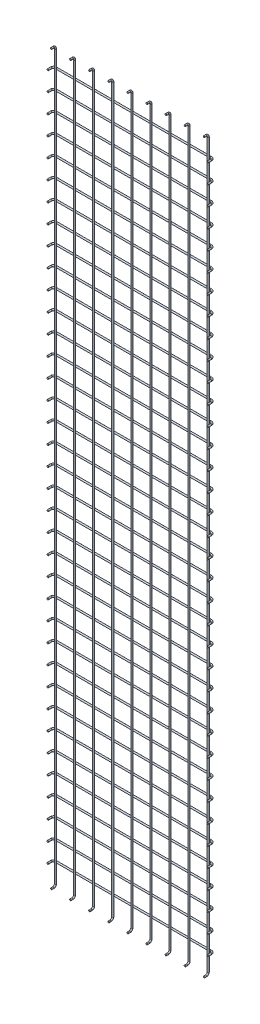
from build123d import *

# Parameters (mm, degrees)
SKETCH_2_R             = 2
PATTERN_LINEAR_1_COUNT = 5
PATTERN_LINEAR_1_PITCH = 50
SKETCH_4_R             = 2
PATTERN_LINEAR_7_COUNT = 19
PATTERN_LINEAR_7_PITCH = 50
PATTERN_LINEAR_8_COUNT = 19
PATTERN_LINEAR_8_PITCH = 50


with BuildPart() as part:
    # По траектории1: sweep along a path in Эскиз1
    with BuildLine(Plane(origin=(0, 0, 0), x_dir=(0, 0, -1), z_dir=(1, 0, 0))) as sweep_1_path:
        Line((-11, 953), (-6, 953))
        ThreePointArc((-6, 953), (-1.757359313, 951.242640687), (0, 947))
        Line((0, 947), (0, -947))
        ThreePointArc((0, -947), (-1.757359313, -951.242640687), (-6, -953))
        Line((-6, -953), (-11, -953))
    # Эскиз2 → По траектории1 (sweep)
    with BuildSketch(Plane.XY.offset(11)):
        with Locations((0, -953)):
            Circle(SKETCH_2_R)
    sweep(path=sweep_1_path.line)


with BuildPart() as pattern_linear_1_1:
    # Линейный массив1: pattern copy
    add(part.part.moved(Location(Vector(-1, 0, 0) * (1 * PATTERN_LINEAR_1_PITCH))))


with BuildPart() as pattern_linear_1_2:
    # Линейный массив1: pattern copy
    add(part.part.moved(Location(Vector(-1, 0, 0) * (2 * PATTERN_LINEAR_1_PITCH))))


with BuildPart() as pattern_linear_1_3:
    # Линейный массив1: pattern copy
    add(part.part.moved(Location(Vector(-1, 0, 0) * (3 * PATTERN_LINEAR_1_PITCH))))


with BuildPart() as pattern_linear_1_4:
    # Линейный массив1: pattern copy
    add(part.part.moved(Location(Vector(-1, 0, 0) * (4 * PATTERN_LINEAR_1_PITCH))))


with BuildPart() as body_6:
    # Зеркальное отражение1: mirrored copy
    add(pattern_linear_1_4.part.mirror(Plane(origin=(0, 0, 0), x_dir=(0, 0, 1), z_dir=(1, 0, 0))))


with BuildPart() as body_7:
    # Mirror 1 2: mirrored copy
    add(pattern_linear_1_3.part.mirror(Plane(origin=(0, 0, 0), x_dir=(0, 0, 1), z_dir=(1, 0, 0))))


with BuildPart() as body_8:
    # Mirror 1 3: mirrored copy
    add(pattern_linear_1_2.part.mirror(Plane(origin=(0, 0, 0), x_dir=(0, 0, 1), z_dir=(1, 0, 0))))


with BuildPart() as body_9:
    # Mirror 1 4: mirrored copy
    add(pattern_linear_1_1.part.mirror(Plane(origin=(0, 0, 0), x_dir=(0, 0, 1), z_dir=(1, 0, 0))))


with BuildPart() as body_10:
    # По траектории2: sweep along a path in Эскиз3
    with BuildLine(Plane(origin=(0, 0, 0), x_dir=(1, 0, 0), z_dir=(0, 1, 0))) as sweep_2_path:
        Line((-209.25, -11), (-209.25, -2))
        ThreePointArc((-209.25, -2), (-207.492640687, 2.242640687), (-203.25, 4))
        Line((-203.25, 4), (203.25, 4))
        ThreePointArc((203.25, 4), (207.492640687, 2.242640687), (209.25, -2))
        Line((209.25, -2), (209.25, -11))
    # Эскиз4 → По траектории2 (sweep)
    with BuildSketch(Plane.XY.offset(11)):
        with Locations((-209.25, 0)):
            Circle(SKETCH_4_R)
    sweep_2 = sweep(path=sweep_2_path.line)


with BuildPart() as pattern_linear_7_1:
    # Линейный массив7: По траектории2 ×19
    with Locations(*[(0, -i * PATTERN_LINEAR_7_PITCH, 0) for i in range(1, PATTERN_LINEAR_7_COUNT)]):
        add(sweep_2)


with BuildPart() as pattern_linear_8_1:
    # Линейный массив8: По траектории2 ×19
    with Locations(*[(0, i * PATTERN_LINEAR_8_PITCH, 0) for i in range(1, PATTERN_LINEAR_8_COUNT)]):
        add(sweep_2)


solid = Compound([part.part, pattern_linear_1_1.part, pattern_linear_1_2.part, pattern_linear_1_3.part, pattern_linear_1_4.part, body_6.part, body_7.part, body_8.part, body_9.part, body_10.part, pattern_linear_7_1.part, pattern_linear_8_1.part])
